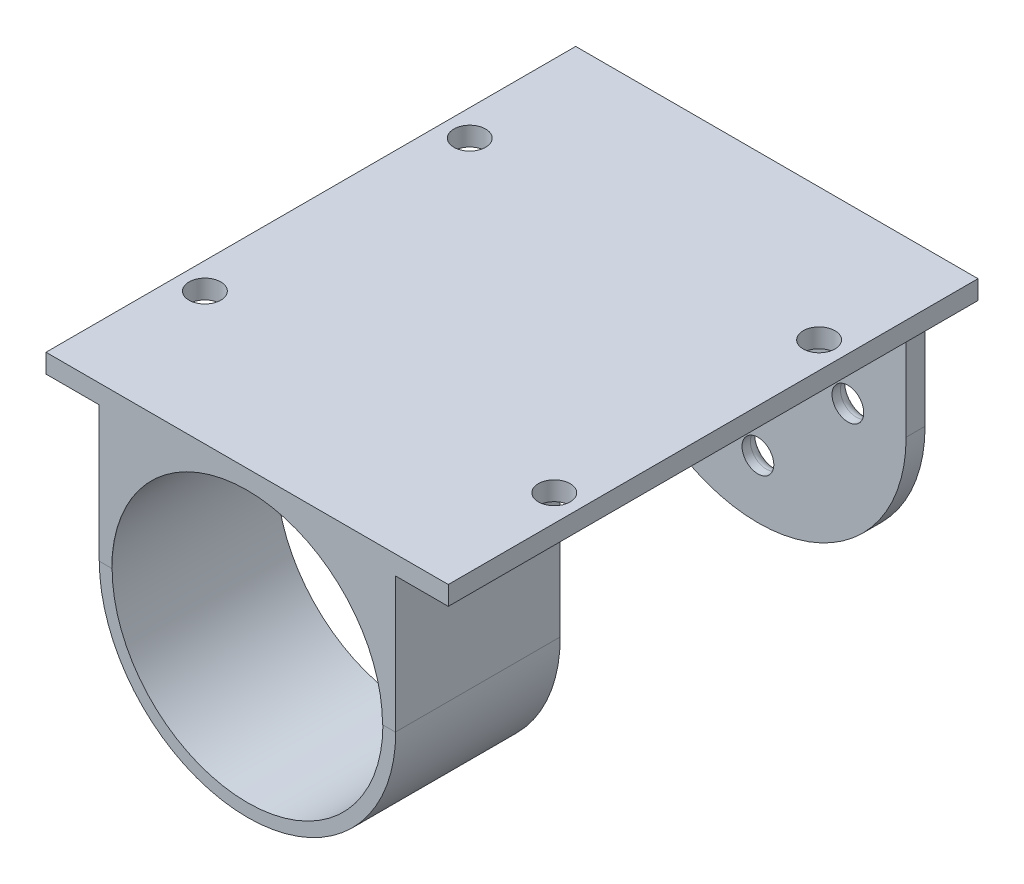
from build123d import *

# Parameters (mm, degrees)
SKETCH1_R                = 14
BOSS_EXTRUDE1_DEPTH      = 50
SKETCH5_W                = 28
SKETCH5_H                = 50.034880911
BOSS_EXTRUDE2_DEPTH      = 21
SKETCH2_R                = 12.791811967
CUT_EXTRUDE1_DEPTH       = 48
SKETCH3_R                = 4
CUT_EXTRUDE2_DEPTH       = 49
SKETCH4_R                = 1.5
CUT_EXTRUDE3_DEPTH       = 49
SKETCH6_R                = 12.79
CUT_EXTRUDE5_DEPTH       = 21
SKETCH7_W                = 28
SKETCH7_H                = 4.634699127
CUT_EXTRUDE6_DEPTH       = 53
SKETCH8_W                = 50.034880911
SKETCH8_H                = 3.58
BOSS_EXTRUDE3_DEPTH      = 5
SKETCH13_R               = 1.5
CUT_EXTRUDE7_DEPTH       = 5
SKETCH14_W               = 50.034880911
SKETCH14_H               = 3.58
BOSS_EXTRUDE4_DEPTH      = 5
SKETCH15_R               = 1.5
CUT_EXTRUDE8_DEPTH       = 5
FILLET1_R                = 1
FILLET2_R                = 1
CUT_EXTRUDE9_DEPTH       = 56.96706514
CUT_EXTRUDE9_DEPTH_BACK  = 56.96706514
SKETCH16_W               = 38
SKETCH16_H               = 1.79
CUT_EXTRUDE10_DEPTH      = 62.684104138
CUT_EXTRUDE10_DEPTH_BACK = 62.684104138
SKETCH19_W               = 32.670016371
SKETCH19_H               = 14
SKETCH19_H_2             = 12.785300873


with BuildPart() as part:
    # Sketch1 → Boss-Extrude1 (new body)
    with BuildSketch(Plane.XY):
        with Locations(Location((0, 0, 0), (0, 0, 180))):
            Circle(SKETCH1_R)
    extrude(amount=BOSS_EXTRUDE1_DEPTH)

    # Sketch5 → Boss-Extrude2 (add)
    with BuildSketch(Plane(origin=(0, 0, 0), x_dir=(1, 0, 0), z_dir=(0, 1, 0))):
        with Locations((0, -25.017440456)):
            Rectangle(SKETCH5_W, SKETCH5_H)
    extrude(amount=BOSS_EXTRUDE2_DEPTH)

    # Sketch2 → Cut-Extrude1 (cut)
    with BuildSketch(Plane.XY.offset(50)):
        Circle(SKETCH2_R)
    extrude(amount=-CUT_EXTRUDE1_DEPTH, mode=Mode.SUBTRACT)

    # Sketch3 → Cut-Extrude2 (cut)
    with BuildSketch(Plane(origin=(0, 0, 0), x_dir=(-1, 0, 0), z_dir=(0, 0, -1))):
        Circle(SKETCH3_R)
    extrude(amount=-CUT_EXTRUDE2_DEPTH, mode=Mode.SUBTRACT)

    # Sketch4 → Cut-Extrude3 (cut)
    with BuildSketch(Plane(origin=(0, 0, 0), x_dir=(-1, 0, 0), z_dir=(0, 0, -1))):
        with Locations((0, -8.5)):
            Circle(SKETCH4_R)
        with Locations((0, 8.5)):
            Circle(SKETCH4_R)
        with Locations((8.5, 0)):
            Circle(SKETCH4_R)
        with Locations((-8.5, 0)):
            Circle(SKETCH4_R)
    extrude(amount=-CUT_EXTRUDE3_DEPTH, mode=Mode.SUBTRACT)

    # Sketch6 → Cut-Extrude5 (cut)
    with BuildSketch(Plane.XY.offset(50.034880911)):
        Circle(SKETCH6_R)
    extrude(amount=-CUT_EXTRUDE5_DEPTH, mode=Mode.SUBTRACT)

    # Sketch7 → Cut-Extrude6 (cut)
    with BuildSketch(Plane.XY.offset(50.034880911)):
        with Locations((0, 18.682650437)):
            Rectangle(SKETCH7_W, SKETCH7_H)
    extrude(amount=-CUT_EXTRUDE6_DEPTH, mode=Mode.SUBTRACT)

    # Sketch8 → Boss-Extrude3 (add)
    with BuildSketch(Plane(origin=(14, 0, 0), x_dir=(0, 0, -1), z_dir=(1, 0, 0))):
        with Locations((-25.017440456, 14.575300873)):
            Rectangle(SKETCH8_W, SKETCH8_H)
    extrude(amount=BOSS_EXTRUDE3_DEPTH)

    # Sketch13 → Cut-Extrude7 (cut)
    with BuildSketch(Plane.XZ.offset(-12.785300873)):
        with Locations(Location((16.5, 37.526160683, 0), (0, 0, 270))):
            Circle(SKETCH13_R)
        with Locations(Location((16.5, 12.508720228, 0), (0, 0, 270))):
            Circle(SKETCH13_R)
    extrude(amount=-CUT_EXTRUDE7_DEPTH, mode=Mode.SUBTRACT)

    # Sketch14 → Boss-Extrude4 (add)
    with BuildSketch(Plane.ZY.offset(14)):
        with Locations((25.017440456, 14.575300873)):
            Rectangle(SKETCH14_W, SKETCH14_H)
    extrude(amount=BOSS_EXTRUDE4_DEPTH)

    # Sketch15 → Cut-Extrude8 (cut)
    with BuildSketch(Plane.XZ.offset(-12.785300873)):
        with Locations(Location((-16.5, 12.508720228, 0), (0, 0, 270))):
            Circle(SKETCH15_R)
        with Locations(Location((-16.5, 37.526160683, 0), (0, 0, 270))):
            Circle(SKETCH15_R)
    extrude(amount=-CUT_EXTRUDE8_DEPTH, mode=Mode.SUBTRACT)

    # Fillet1
    fillet1_edges = [part.edges().sort_by_distance(p)[0] for p in [
        (10, 0, 0),
    ]]
    fillet(fillet1_edges, radius=FILLET1_R)

    # Fillet2
    fillet2_edges = [part.edges().sort_by_distance(p)[0] for p in [
        (1.5, -8.5, 0),
        (1.5, 8.5, 0),
        (-7, 0, 0),
    ]]
    fillet(fillet2_edges, radius=FILLET2_R)

    # Sketch16 → Cut-Extrude9 (cut, two sides: drawn at the far end of the back side and taken through both)
    with BuildSketch(Plane(origin=(0, 0, 0), x_dir=(-1, 0, 0), z_dir=(0, 0, -1)).offset(-CUT_EXTRUDE9_DEPTH_BACK)):
        with Locations((0, 15.470300873)):
            Rectangle(SKETCH16_W, SKETCH16_H)
    extrude(amount=CUT_EXTRUDE9_DEPTH + CUT_EXTRUDE9_DEPTH_BACK, mode=Mode.SUBTRACT)

    # Sketch19 → Cut-Extrude10 (cut, two sides: drawn at the far end of the back side and taken through both)
    with BuildSketch(Plane(origin=(14, 0, 0), x_dir=(0, 0, -1), z_dir=(1, 0, 0)).offset(-CUT_EXTRUDE10_DEPTH_BACK)):
        with Locations((-18.125008186, -7)):
            Rectangle(SKETCH19_W, SKETCH19_H)
        with Locations((-18.125008186, 6.392650437)):
            Rectangle(SKETCH19_W, SKETCH19_H_2)
    extrude(amount=CUT_EXTRUDE10_DEPTH + CUT_EXTRUDE10_DEPTH_BACK, mode=Mode.SUBTRACT)


solid = part.part
